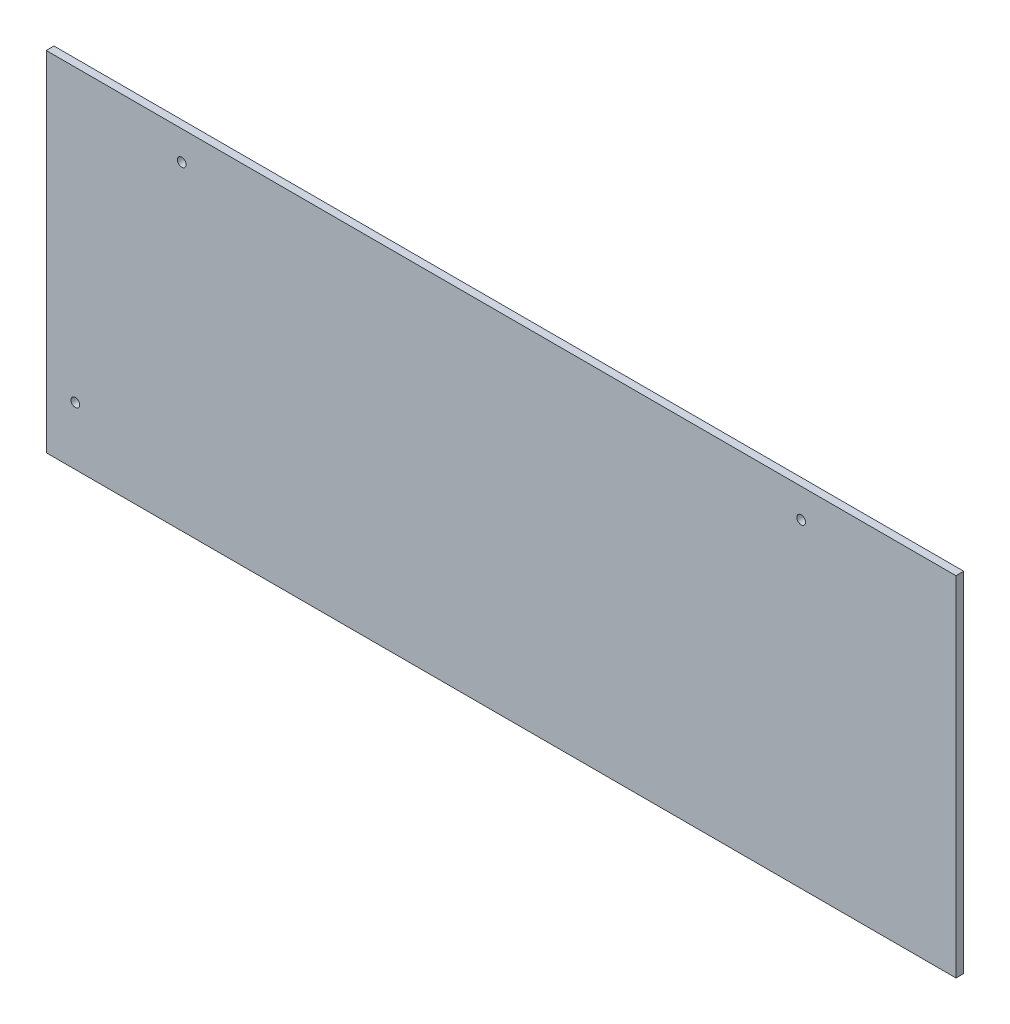
from build123d import *

# Parameters (mm, degrees)
SKETCH1_W           = 470
SKETCH1_H           = 180
BOSS_EXTRUDE1_DEPTH = 2
SKETCH2_R           = 2.25
CUT_EXTRUDE1_DEPTH  = 297.042226718


with BuildPart() as part:
    # Sketch1 → Boss-Extrude1 (new, symmetric)
    with BuildSketch(Plane.XY):
        with Locations((0, -90)):
            Rectangle(SKETCH1_W, SKETCH1_H)
    extrude(amount=BOSS_EXTRUDE1_DEPTH, both=True)

    # Sketch2 → Cut-Extrude1 (cut, through all)
    with BuildSketch(Plane.XY.offset(2)):
        with Locations((-165, -15)):
            Circle(SKETCH2_R)
        with Locations((155, -15)):
            Circle(SKETCH2_R)
        with Locations((-220, -150)):
            Circle(SKETCH2_R)
    extrude(amount=-CUT_EXTRUDE1_DEPTH, mode=Mode.SUBTRACT)


solid = part.part
